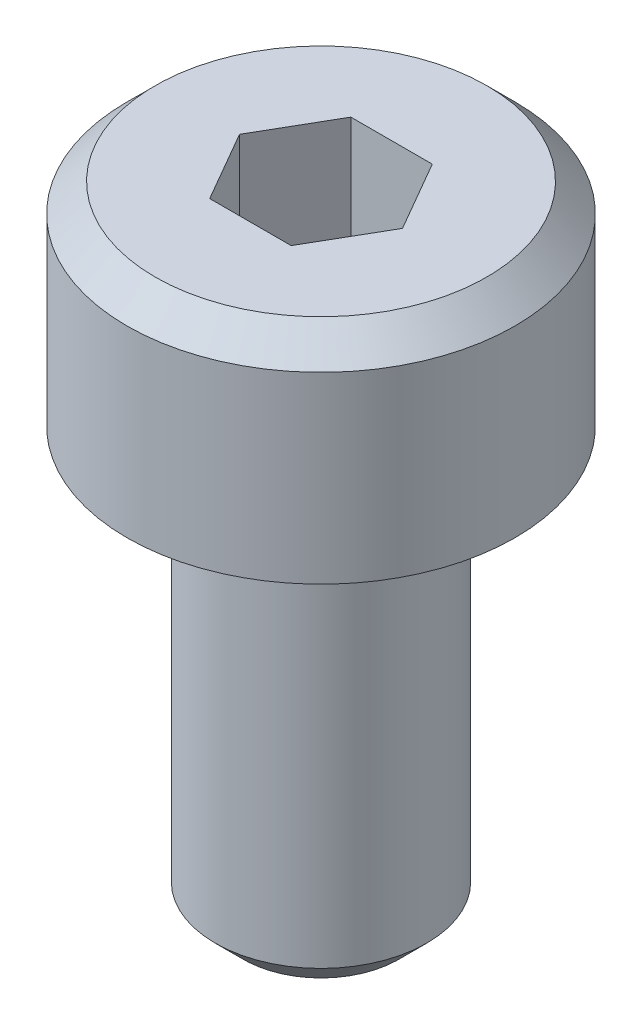
from build123d import *

# Parameters (mm, degrees)
CHAMFER1_SIZE      = 0.4
CUT_EXTRUDE2_DEPTH = 4


with BuildPart() as part:
    # Sketch2 → Revolve1 (revolve)
    with BuildSketch(Plane.XY, mode=Mode.PRIVATE) as revolve1_sk:
        Polygon((0, 9), (2.75, 9), (2.75, 6), (1.5, 6), (1.5, 0), (0, 0), align=None)
    revolve(revolve1_sk.sketch.rotate(Axis((0, 0, 0), (0, 1, 0)), 90), axis=Axis((0, 0, 0), (0, 1, 0)))

    # Chamfer1
    chamfer1_edges = [part.edges().sort_by_distance(p)[0] for p in [
        (0, 0, 1.5),
        (0, 9, 2.75),
    ]]
    chamfer(chamfer1_edges, length=CHAMFER1_SIZE)

    # Sketch4 → Cut-Extrude2 (cut)
    with BuildSketch(Plane(origin=(0, 9, 0), x_dir=(1, 0, 0), z_dir=(0, 1, 0))):
        Polygon((1.154700538, 0), (0.577350269, 1), (-0.577350269, 1), (-1.154700538, 0), (-0.577350269, -1), (0.577350269, -1), align=None)
    extrude(amount=-CUT_EXTRUDE2_DEPTH, mode=Mode.SUBTRACT)


solid = part.part
